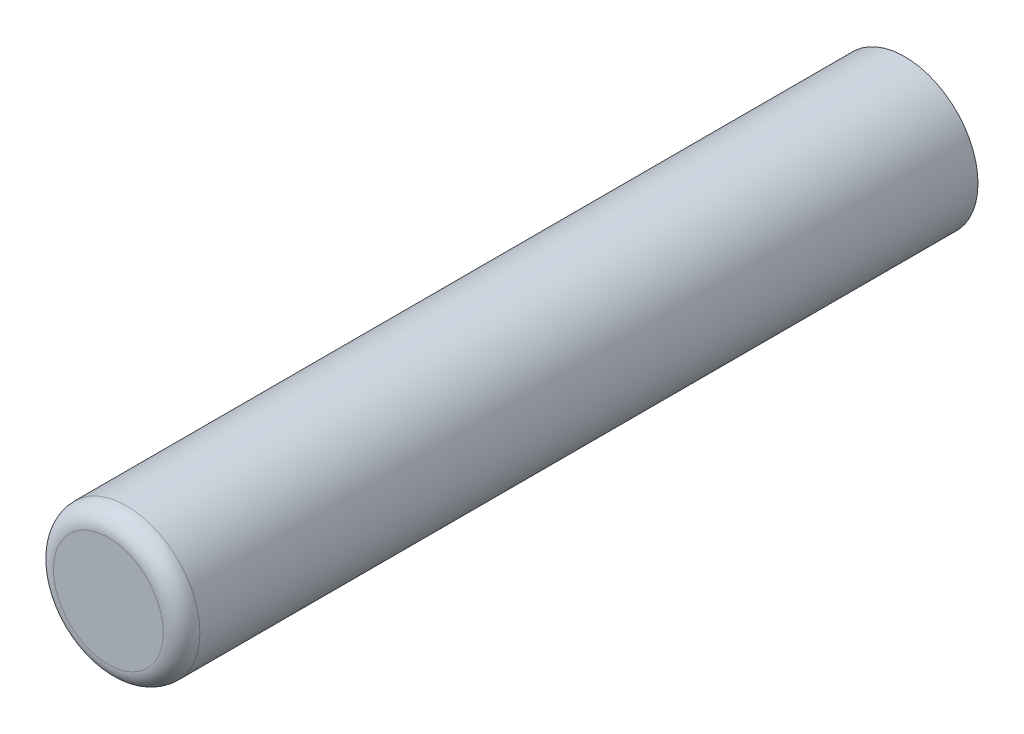
from build123d import *

# Parameters (mm, degrees)
CROQUIS1_R              = 8
SALIENTE_EXTRUIR1_DEPTH = 87
REDONDEO1_R             = 2
CROQUIS3_R              = 5
CORTAR_EXTRUIR1_DEPTH   = 25


with BuildPart() as part:
    # Croquis1 → Saliente-Extruir1 (new body)
    with BuildSketch(Plane.XY):
        Circle(CROQUIS1_R)
    extrude(amount=SALIENTE_EXTRUIR1_DEPTH)

    # Redondeo1
    redondeo1_edges = [part.edges().sort_by_distance(p)[0] for p in [
        (-8, 0, 87),
    ]]
    fillet(redondeo1_edges, radius=REDONDEO1_R)

    # Croquis3 → Cortar-Extruir1 (cut)
    with BuildSketch(Plane(origin=(0, 0, 0), x_dir=(-1, 0, 0), z_dir=(0, 0, -1))):
        Circle(CROQUIS3_R)
    extrude(amount=-CORTAR_EXTRUIR1_DEPTH, mode=Mode.SUBTRACT)


solid = part.part
